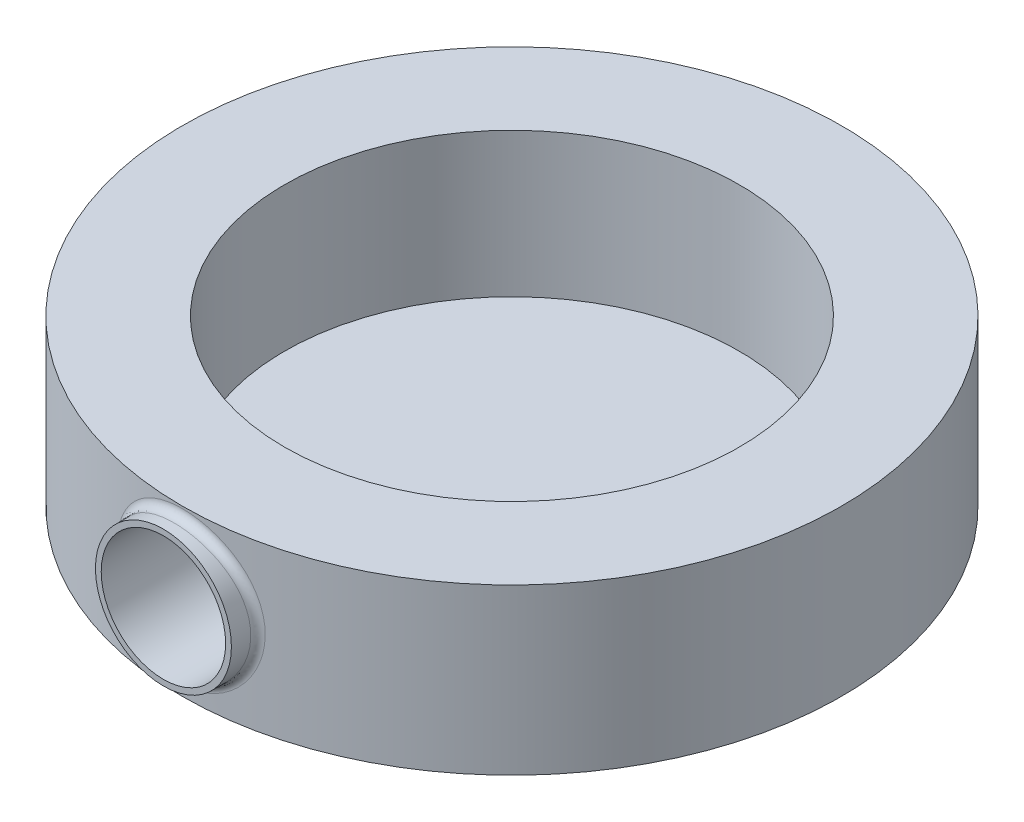
from build123d import *

# Parameters (mm, degrees)
SKETCH1_R           = 400
BOSS_EXTRUDE1_DEPTH = 200
BOSS_EXTRUDE2_START = -10
SKETCH2_R           = 82.5
SKETCH2_R_2         = 75.5
BOSS_EXTRUDE2_DEPTH = 33
CUT_EXTRUDE1_START  = -432
SKETCH2_2_R         = 75.5
CUT_EXTRUDE1_DEPTH  = 432
SKETCH3_R           = 275.958825931
CUT_EXTRUDE3_DEPTH  = 175
FILLET2_R           = 10


with BuildPart() as part:
    # Sketch1 → Boss-Extrude1 (new body)
    with BuildSketch(Plane(origin=(0, 0, 0), x_dir=(1, 0, 0), z_dir=(0, 1, 0))):
        Circle(SKETCH1_R)
    extrude(amount=BOSS_EXTRUDE1_DEPTH)

    # Sketch2 → Boss-Extrude2 (add)
    with BuildSketch(Plane.XY.offset(400).offset(BOSS_EXTRUDE2_START)):
        with Locations((0, 104.933431854)):
            Circle(SKETCH2_R)
        with Locations((0, 104.933431854)):
            Circle(SKETCH2_R_2, mode=Mode.SUBTRACT)
    extrude(amount=BOSS_EXTRUDE2_DEPTH)

    # Sketch2<2> → Cut-Extrude1 (cut)
    with BuildSketch(Plane.XY.offset(400).offset(CUT_EXTRUDE1_START)):
        with Locations((0, 104.933431854)):
            Circle(SKETCH2_2_R)
    extrude(amount=CUT_EXTRUDE1_DEPTH, mode=Mode.SUBTRACT)

    # Sketch3 → Cut-Extrude3 (cut)
    with BuildSketch(Plane(origin=(0, 200, 0), x_dir=(1, 0, 0), z_dir=(0, 1, 0))):
        Circle(SKETCH3_R)
    extrude(amount=-CUT_EXTRUDE3_DEPTH, mode=Mode.SUBTRACT)

    # Fillet2
    fillet2_edges = [part.edges().sort_by_distance(p)[0] for p in [
        (-82.5, 104.933431854, 391.399731732),
    ]]
    fillet(fillet2_edges, radius=FILLET2_R)


solid = part.part
